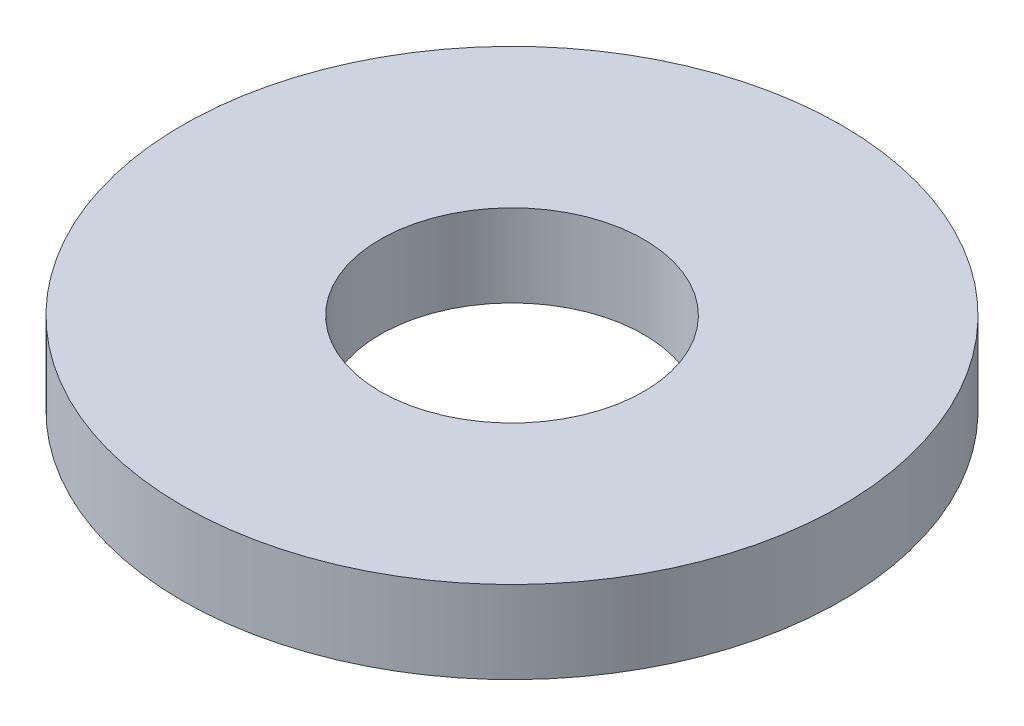
from build123d import *

# Parameters (mm, degrees)
SKETCH1_R           = 6.35
SKETCH1_R_2         = 2.54
BOSS_EXTRUDE1_DEPTH = 1.5875


with BuildPart() as part:
    # Sketch1 → Boss-Extrude1 (new body)
    with BuildSketch(Plane(origin=(0, 0, 0), x_dir=(1, 0, 0), z_dir=(0, 1, 0))):
        with Locations(Location((0, 0, 0), (0, 0, 270))):
            Circle(SKETCH1_R)
        with Locations(Location((0, 0, 0), (0, 0, 270))):
            Circle(SKETCH1_R_2, mode=Mode.SUBTRACT)
    extrude(amount=BOSS_EXTRUDE1_DEPTH)


solid = part.part
